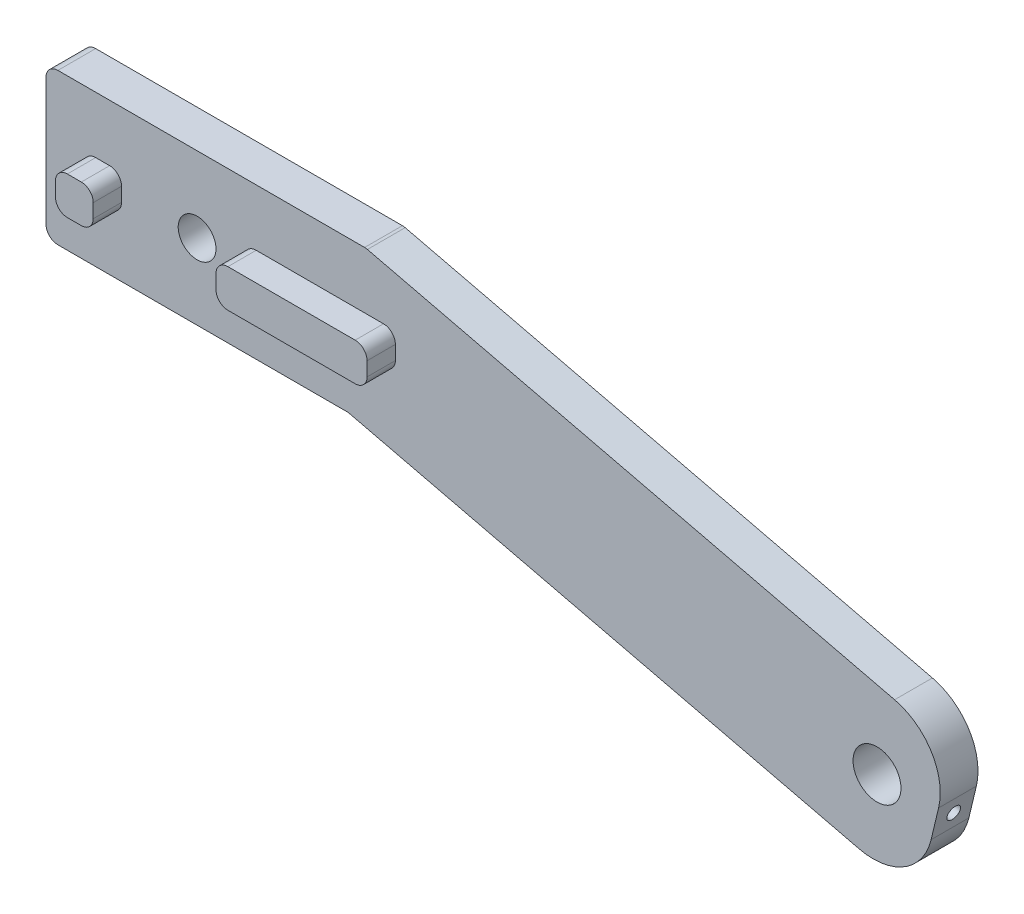
from build123d import *

# Parameters (mm, degrees)
SKETCH1_R               = 3.175
SKETCH1_R_2             = 4.025
BOSS_EXTRUDE1_DEPTH     = 6.35
CUT_EXTRUDE2_REACH      = 155.866
CUT_EXTRUDE2_END_RADIUS = 4.025
SKETCH3_R               = 1.1303
FILLET4_R               = 10
SKETCH4_W               = 6.35
SKETCH4_H               = 6.35
SKETCH4_W_2             = 25.4
BOSS_EXTRUDE2_DEPTH     = 4.7625
FILLET3_R               = 2


with BuildPart() as part:
    # Sketch1 → Boss-Extrude1 (new body)
    with BuildSketch(Plane.XY):
        Polygon((-38.1, -12.7), (-38.1, 12.7), (15.701735639, 12.7), (114.28491418, -10.930870684), (108.364133554, -35.631161305), (12.7, -12.7), align=None)
        with Locations((-12.7, 0)):
            Circle(SKETCH1_R, mode=Mode.SUBTRACT)
        with Locations((101.6, -20.95)):
            Circle(SKETCH1_R_2, mode=Mode.SUBTRACT)
    extrude(amount=BOSS_EXTRUDE1_DEPTH)

    # Cut-Extrude2: up to this cylinder (the profile starts outside it)
    cut_extrude2_end = Plane(origin=(101.6, -20.95, 3.175), z_dir=(0, 0, -1)) * Cylinder(CUT_EXTRUDE2_END_RADIUS, 320.782, mode=Mode.PRIVATE)
    # Sketch3 → Cut-Extrude2 (cut, up to the surface)
    with BuildSketch(Plane(origin=(110.552900462, -26.500071647, 0), x_dir=(0, 0, -1), z_dir=(0.9724523866696595, -0.23310159943784806, 0)), mode=Mode.PRIVATE) as cut_extrude2_sk1:
        with Locations(Location((-3.175, 3.310245002, 0), (0, 0, 90))):
            Circle(SKETCH3_R)
    cut_extrude2_tool1 = extrude(cut_extrude2_sk1.sketch, amount=-CUT_EXTRUDE2_REACH, mode=Mode.PRIVATE) - cut_extrude2_end
    add(cut_extrude2_tool1.solids().sort_by_distance((111.324524, -23.281016, 3.175))[0], mode=Mode.SUBTRACT)

    # Fillet4
    fillet4_edges = [part.edges().sort_by_distance(p)[0] for p in [
        (108.364133554, -35.631161305, 3.175),
        (114.28491418, -10.930870684, 3.175),
    ]]
    fillet(fillet4_edges, radius=FILLET4_R)

    # Sketch4 → Boss-Extrude2 (add)
    with BuildSketch(Plane.XY.offset(6.35)):
        with Locations((-28.575, 0)):
            Rectangle(SKETCH4_W, SKETCH4_H)
        with Locations((7.9375, 0)):
            Rectangle(SKETCH4_W_2, SKETCH4_H)
    extrude(amount=BOSS_EXTRUDE2_DEPTH)

    # Fillet3
    fillet3_edges = [part.edges().sort_by_distance(p)[0] for p in [
        (12.7, -12.7, 3.175),
        (-38.1, -12.7, 3.175),
        (-38.1, 12.7, 3.175),
        (15.701735639, 12.7, 3.175),
        (-31.75, -3.175, 8.73125),
        (-25.4, -3.175, 8.73125),
        (-25.4, 3.175, 8.73125),
        (-31.75, 3.175, 8.73125),
        (-4.7625, -3.175, 8.73125),
        (20.6375, -3.175, 8.73125),
        (20.6375, 3.175, 8.73125),
        (-4.7625, 3.175, 8.73125),
    ]]
    fillet(fillet3_edges, radius=FILLET3_R)


solid = part.part
